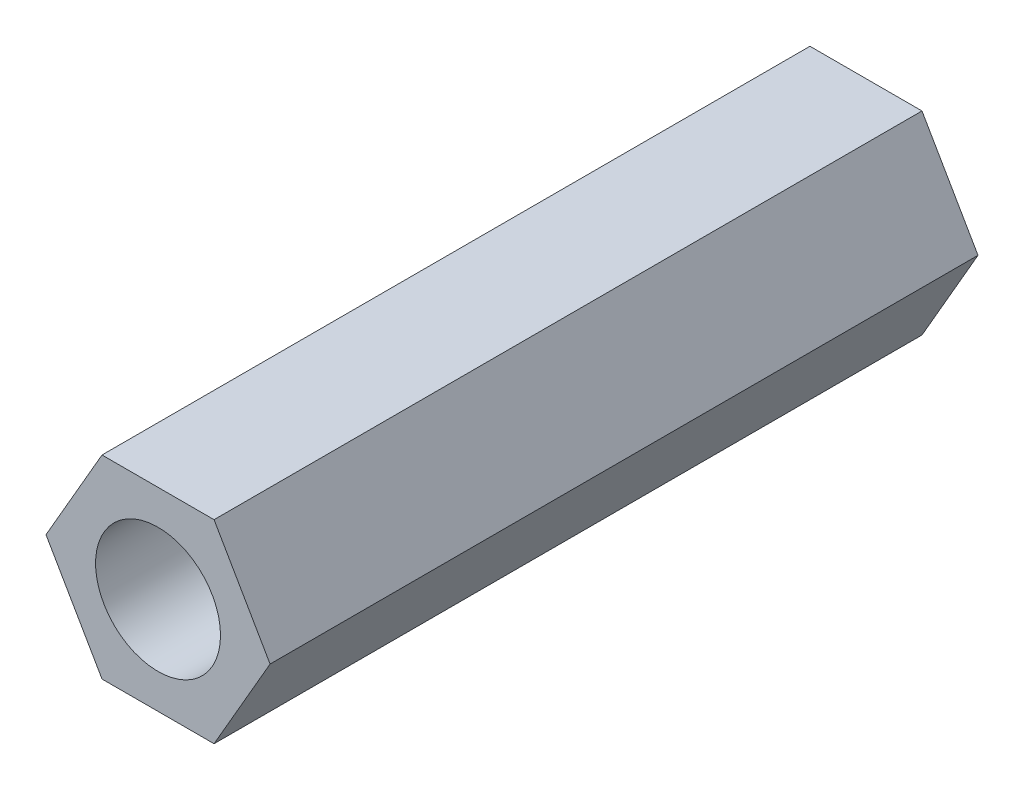
from build123d import *

# Parameters (mm, degrees)
BOSS_EXTRUDE1_DEPTH = 17
SKETCH2_R           = 1.5
CUT_EXTRUDE1_DEPTH  = 17


with BuildPart() as part:
    # Sketch1 → Boss-Extrude1 (new body)
    with BuildSketch(Plane.XY):
        Polygon((2.690452254, 0), (1.345226127, 2.33), (-1.345226127, 2.33), (-2.690452254, 0), (-1.345226127, -2.33), (1.345226127, -2.33), align=None)
    extrude(amount=BOSS_EXTRUDE1_DEPTH)

    # Sketch2 → Cut-Extrude1 (cut)
    with BuildSketch(Plane.XY.offset(17)):
        Circle(SKETCH2_R)
    extrude(amount=-CUT_EXTRUDE1_DEPTH, mode=Mode.SUBTRACT)


solid = part.part
